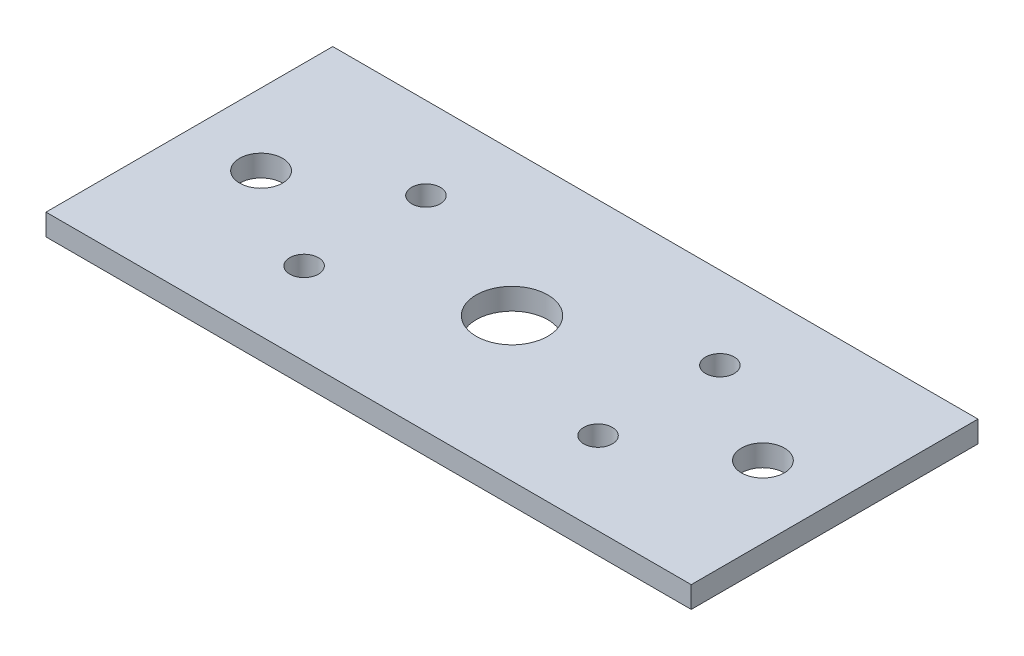
from build123d import *

# Parameters (mm, degrees)
SKETCH_1_W      = 90
SKETCH_1_H      = 40
SKETCH_1_R      = 5
SKETCH_1_R_2    = 3
SKETCH_1_R_3    = 2
EXTRUDE_1_DEPTH = 3


with BuildPart() as part:
    # 草图1 → 凸台-拉伸1 (new body)
    with BuildSketch(Plane(origin=(0, 0, 0), x_dir=(1, 0, 0), z_dir=(0, 1, 0))):
        Rectangle(SKETCH_1_W, SKETCH_1_H)
        with Locations(Location((0, 0, 0), (0, 0, 270))):
            Circle(SKETCH_1_R, mode=Mode.SUBTRACT)
        with Locations(Location((-35, 0, 0), (0, 0, 270))):
            Circle(SKETCH_1_R_2, mode=Mode.SUBTRACT)
        with Locations(Location((35, 0, 0), (0, 0, 270))):
            Circle(SKETCH_1_R_2, mode=Mode.SUBTRACT)
        with Locations(Location((-20.5, 8.5, 0), (0, 0, 270))):
            Circle(SKETCH_1_R_3, mode=Mode.SUBTRACT)
        with Locations(Location((20.5, 8.5, 0), (0, 0, 270))):
            Circle(SKETCH_1_R_3, mode=Mode.SUBTRACT)
        with Locations(Location((20.5, -8.5, 0), (0, 0, 270))):
            Circle(SKETCH_1_R_3, mode=Mode.SUBTRACT)
        with Locations(Location((-20.5, -8.5, 0), (0, 0, 270))):
            Circle(SKETCH_1_R_3, mode=Mode.SUBTRACT)
    extrude(amount=EXTRUDE_1_DEPTH)


solid = part.part
